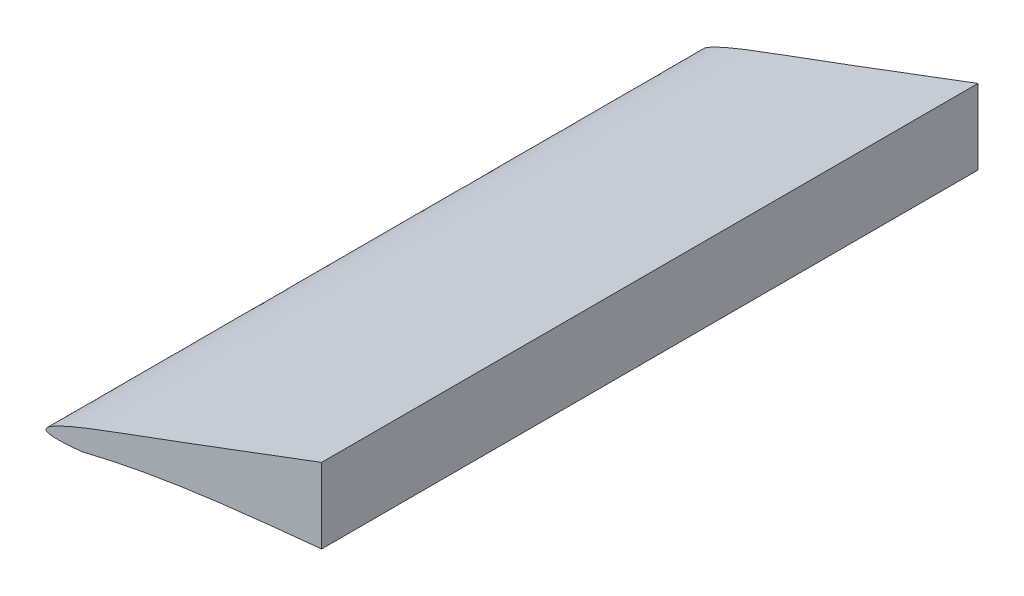
from build123d import *

# Parameters (mm, degrees)
SKETCH1_R               = 2.032
BOSS_EXTRUDE1_DEPTH     = 39.37
CUT_EXTRUDE2_DEPTH      = 62.664828162
CUT_EXTRUDE2_DEPTH_BACK = 62.664828162
SKETCH3_W               = 64.931431168
SKETCH3_H               = 41.251540677


with BuildPart() as part:
    # Sketch1 → Boss-Extrude1 (new body)
    with BuildSketch(Plane.XY):
        with BuildLine():
            ThreePointArc((20.568025107, -2.262743193), (25.492605461, 0.119444869), (27.551899423, 5.187543131))
            ThreePointArc((27.551899423, 5.187543131), (24.489282859, 11.152254923), (17.899072442, 12.38778462))
            add(Edge.make_bspline(
                [(17.899072442, 12.38778462), (11.779016726, 10.69250234), (-2.958574168, 6.431868525), (-24.080278159, -0.407648755), (-34.99363821, -4.735815006), (-48.537358713, -9.634849887), (-43.566754384, -9.118513058)],
                knots=[0, 0, 0, 0, 0.056261028, 0.133578719, 0.179880978, 0.203822749, 0.203822749, 0.203822749, 0.203822749], degree=3))
            add(Edge.make_bspline(
                [(-43.566754384, -9.118513058), (-37.677273054, -7.647687935), (-27.709948033, -7.024655832), (-9.984463479, -4.604286441), (5.433214693, -3.691229751), (16.924119008, -2.567827505), (20.534293367, -2.265562996), (20.568025107, -2.262743193)],
                knots=[0.794337025, 0.794337025, 0.794337025, 0.794337025, 0.852124106, 0.889611916, 0.965358143, 0.999676327, 1, 1, 1, 1], degree=3))
        make_face()
        with Locations((19.933245616, 5.044315447)):
            Circle(SKETCH1_R, mode=Mode.SUBTRACT)
    extrude(amount=BOSS_EXTRUDE1_DEPTH)

    # Sketch3 → Cut-Extrude2 (cut, two sides: drawn at the far end of the back side and taken through both)
    with BuildSketch(Plane.XY.offset(39.37).offset(-CUT_EXTRUDE2_DEPTH_BACK)):
        with Locations((3.255715584, 2.352823332)):
            Rectangle(SKETCH3_W, SKETCH3_H)
    extrude(amount=CUT_EXTRUDE2_DEPTH + CUT_EXTRUDE2_DEPTH_BACK, mode=Mode.SUBTRACT)


solid = part.part
